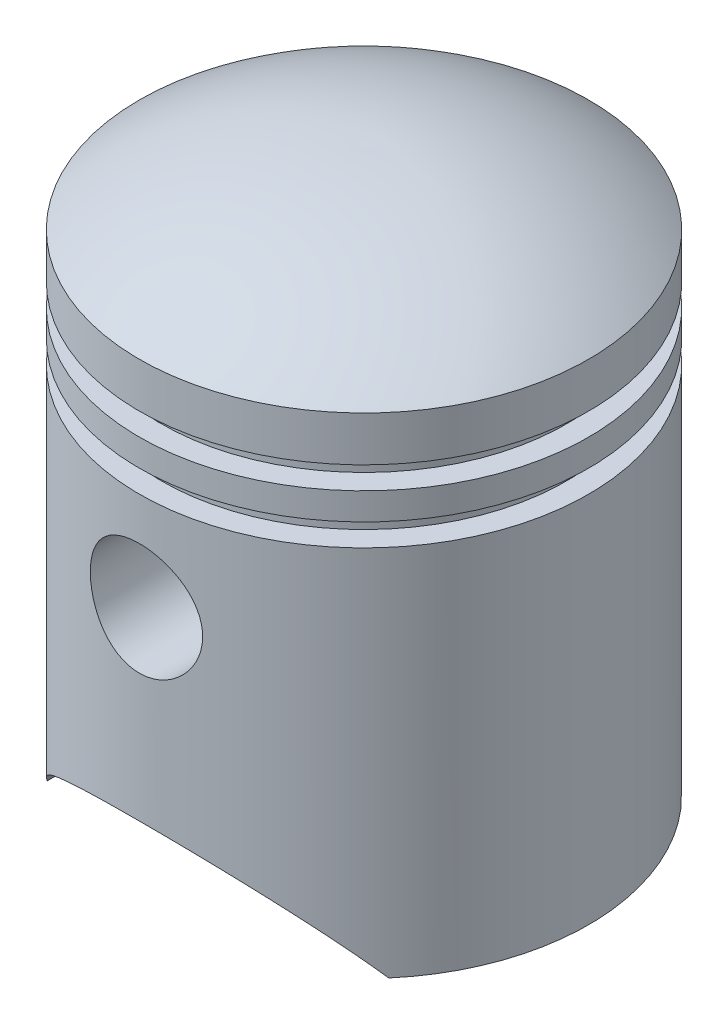
from build123d import *

# Parameters (mm, degrees)
CUT_EXTRUDE1_DEPTH       = 72.817566835
CUT_EXTRUDE1_DEPTH_BACK  = 72.817566835
SKETCH3_R                = 6.25
BOSS_EXTRUDE1_REACH      = 85.818
BOSS_EXTRUDE1_END_RADIUS = 23
BOSS_EXTRUDE1_START      = 12
SKETCH4_R                = 7.25
SKETCH4_R_2              = 6.25


with BuildPart() as part:
    # Sketch2 → Revolve1 (revolve)
    with BuildSketch(Plane.XY, mode=Mode.PRIVATE) as revolve1_sk:
        with BuildLine():
            Line((25, 0), (25, 41.5))
            Line((25, 41.5), (22.5, 41.5))
            Line((22.5, 41.5), (22.5, 44))
            Line((22.5, 44), (25, 44))
            Line((25, 44), (25, 47))
            Line((25, 47), (22.5, 47))
            Line((22.5, 47), (22.5, 49.5))
            Line((22.5, 49.5), (25, 49.5))
            Line((25, 49.5), (25, 54.5))
            ThreePointArc((25, 54.5), (13.174901691, 60.609067785), (0, 62.5))
            Line((0, 62.5), (0, 60.49936285))
            ThreePointArc((0, 60.49936285), (12.069492637, 58.859165445), (23, 53.484511145))
            Line((23, 53.484511145), (23, 51.5))
            Line((23, 51.5), (20.5, 51.5))
            Line((20.5, 51.5), (20.5, 45.5))
            Line((20.5, 45.5), (20.5, 39.5))
            Line((20.5, 39.5), (23, 39.5))
            Line((23, 39.5), (23, 0))
            Line((23, 0), (25, 0))
        make_face()
    revolve(revolve1_sk.sketch.rotate(Axis((0, 62.5, 0), (0, -1, 0)), 180), axis=Axis((0, 62.5, 0), (0, -1, 0)))

    # Sketch3 → Cut-Extrude1 (cut, two sides: drawn at the far end of the back side and taken through both)
    with BuildSketch(Plane.XY.offset(-CUT_EXTRUDE1_DEPTH_BACK)):
        with Locations((0, 30.5)):
            Circle(SKETCH3_R)
        with BuildLine():
            Line((-19, 0), (19, 0))
            ThreePointArc((19, 0), (0, 10), (-19, 0))
        make_face()
    extrude(amount=CUT_EXTRUDE1_DEPTH + CUT_EXTRUDE1_DEPTH_BACK, mode=Mode.SUBTRACT)

    # Boss-Extrude1: up to this cylinder (the profile starts inside it)
    boss_extrude1_end = Plane(origin=(0, 30.5, 0), z_dir=(0, 1, 0)) * Cylinder(BOSS_EXTRUDE1_END_RADIUS, 218.636, mode=Mode.PRIVATE)
    # Sketch4 → Boss-Extrude1 (add, up to the surface)
    with BuildSketch(Plane.XY.offset(BOSS_EXTRUDE1_START), mode=Mode.PRIVATE) as boss_extrude1_sk1:
        with Locations(Location((0, 30.5, 0), (0, 0, 180))):
            Circle(SKETCH4_R)
        with Locations((0, 30.5)):
            Circle(SKETCH4_R_2, mode=Mode.SUBTRACT)
    boss_extrude1_tool1 = extrude(boss_extrude1_sk1.sketch, amount=BOSS_EXTRUDE1_REACH, mode=Mode.PRIVATE) & boss_extrude1_end
    boss_extrude1 = boss_extrude1_tool1.solids().sort_by_distance((7.044939, 30.5, 12))[0]
    add(boss_extrude1)

    # Mirror1: Boss-Extrude1 across plane
    add(boss_extrude1.mirror(Plane.XY))


solid = part.part
